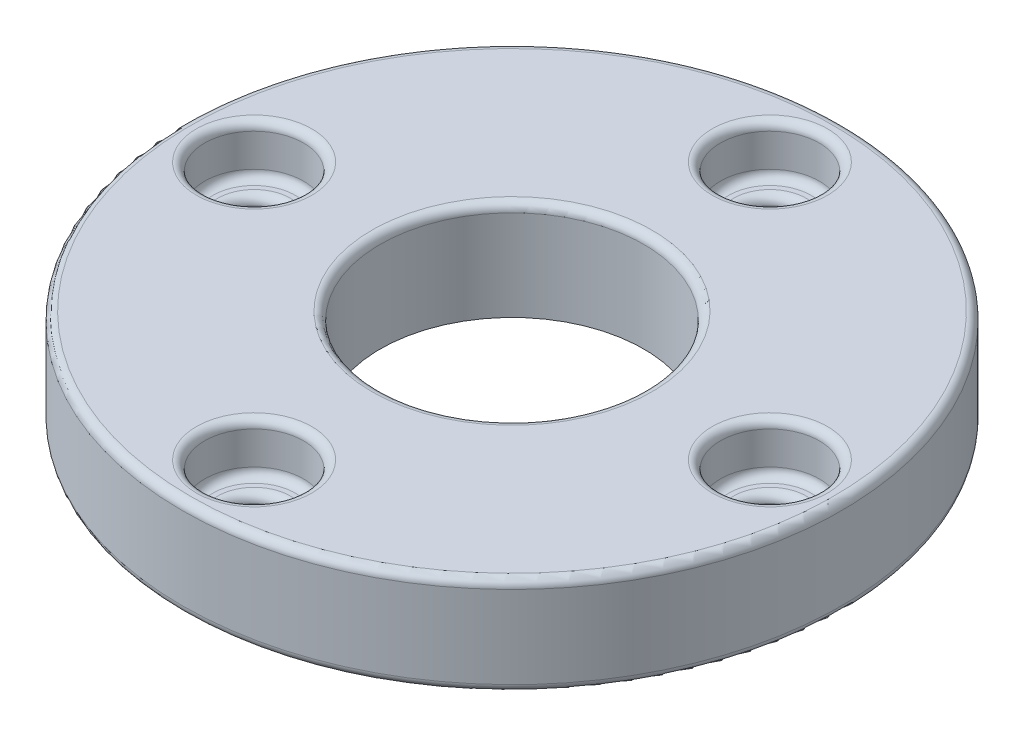
from build123d import *

# Parameters (mm, degrees)
SKETCH2_R           = 20
BOSS_EXTRUDE1_DEPTH = 6
SKETCH3_R           = 8
CUT_EXTRUDE1_DEPTH  = 29.91366459
SKETCH4_R           = 1.7
CUT_EXTRUDE2_DEPTH  = 29.91366459
SKETCH5_R           = 3
CUT_EXTRUDE3_DEPTH  = 3
FILLET1_R           = 0.5
FILLET2_R           = 0.5
FILLET3_R           = 0.5


with BuildPart() as part:
    # Sketch2 → Boss-Extrude1 (new body)
    with BuildSketch(Plane(origin=(0, 0, 0), x_dir=(1, 0, 0), z_dir=(0, 1, 0))):
        with Locations(Location((0, 0, 0), (0, 0, 270))):
            Circle(SKETCH2_R)
    extrude(amount=BOSS_EXTRUDE1_DEPTH)

    # Sketch3 → Cut-Extrude1 (cut, through all)
    with BuildSketch(Plane(origin=(0, 6, 0), x_dir=(1, 0, 0), z_dir=(0, 1, 0))):
        with Locations(Location((0, 0, 0), (0, 0, 270))):
            Circle(SKETCH3_R)
    extrude(amount=-CUT_EXTRUDE1_DEPTH, mode=Mode.SUBTRACT)

    # Sketch4 → Cut-Extrude2 (cut, through all)
    with BuildSketch(Plane(origin=(0, 6, 0), x_dir=(1, 0, 0), z_dir=(0, 1, 0))):
        with Locations(Location((0, 15.65, 0), (0, 0, 270))):
            Circle(SKETCH4_R)
        with Locations(Location((-15.65, 0, 0), (0, 0, 270))):
            Circle(SKETCH4_R)
        with Locations(Location((0, -15.65, 0), (0, 0, 270))):
            Circle(SKETCH4_R)
        with Locations(Location((15.65, 0, 0), (0, 0, 270))):
            Circle(SKETCH4_R)
    extrude(amount=-CUT_EXTRUDE2_DEPTH, mode=Mode.SUBTRACT)

    # Sketch5 → Cut-Extrude3 (cut)
    with BuildSketch(Plane(origin=(0, 6, 0), x_dir=(1, 0, 0), z_dir=(0, 1, 0))):
        with Locations(Location((0, 15.65, 0), (0, 0, 270))):
            Circle(SKETCH5_R)
        with Locations(Location((-15.65, 0, 0), (0, 0, 270))):
            Circle(SKETCH5_R)
        with Locations(Location((0, -15.65, 0), (0, 0, 270))):
            Circle(SKETCH5_R)
        with Locations(Location((15.65, 0, 0), (0, 0, 270))):
            Circle(SKETCH5_R)
    extrude(amount=-CUT_EXTRUDE3_DEPTH, mode=Mode.SUBTRACT)

    # Fillet1
    fillet1_edges = [part.edges().sort_by_distance(p)[0] for p in [
        (0, 6, -18.65),
        (-15.65, 6, -3),
        (0, 6, 12.65),
        (15.65, 6, -3),
        (0, 6, -20),
        (0, 6, -8),
    ]]
    fillet(fillet1_edges, radius=FILLET1_R)

    # Fillet2
    fillet2_edges = [part.edges().sort_by_distance(p)[0] for p in [
        (0, 3, -18.65),
        (0, 3, -17.35),
        (-15.65, 3, -3),
        (-15.65, 3, -1.7),
        (0, 3, 12.65),
        (0, 3, 13.95),
        (15.65, 3, -3),
        (15.65, 3, -1.7),
    ]]
    fillet(fillet2_edges, radius=FILLET2_R)

    # Fillet3
    fillet3_edges = [part.edges().sort_by_distance(p)[0] for p in [
        (0, 0, -20),
    ]]
    fillet(fillet3_edges, radius=FILLET3_R)


solid = part.part
